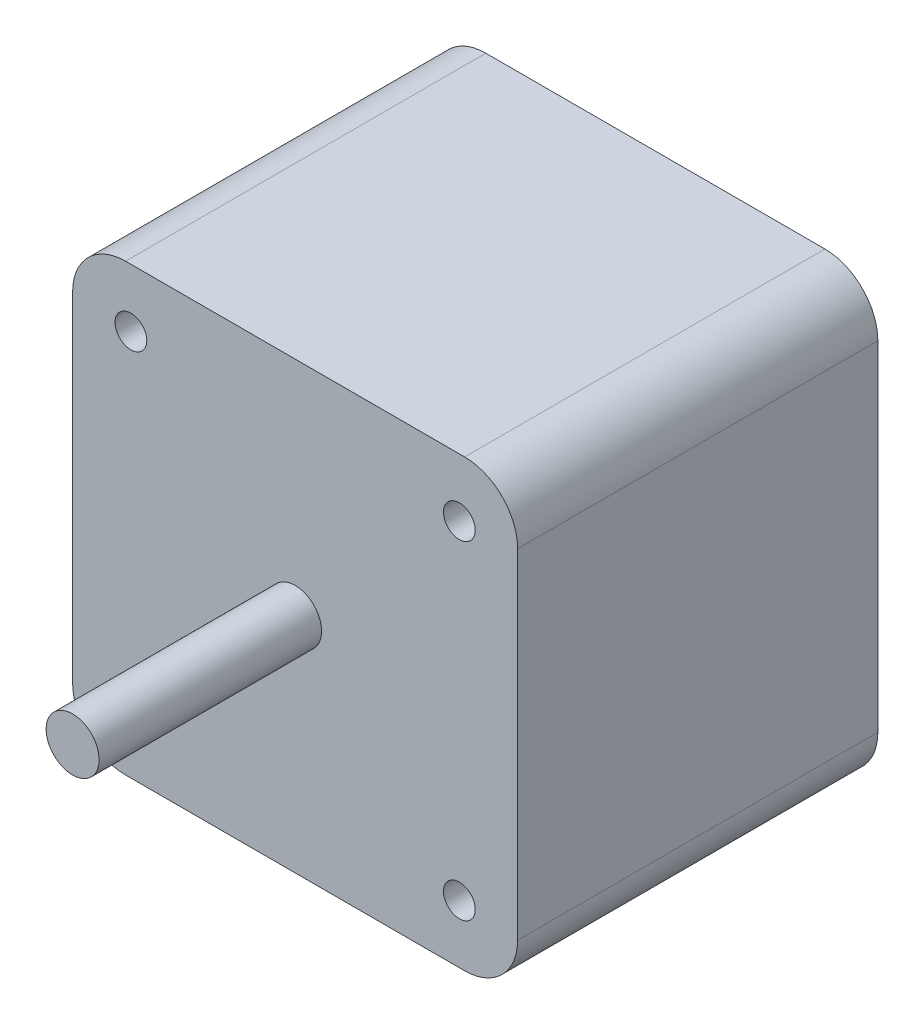
from build123d import *

# Parameters (mm, degrees)
SZKIC1_W                    = 42
SZKIC1_H                    = 42
DODANIE_WYCI_GNI_CIE1_DEPTH = 34
SZKIC2_R                    = 1.5
WYTNIJ_WYCI_GNI_CIE1_DEPTH  = 11
SZKIC6_R                    = 1.5
WYTNIJ_WYCI_GNI_CIE2_DEPTH  = 11
SZKIC7_R                    = 1.5
WYTNIJ_WYCI_GNI_CIE3_DEPTH  = 11
SZKIC8_R                    = 1.5
WYTNIJ_WYCI_GNI_CIE4_DEPTH  = 11
ZAOKR_GLENIE1_R             = 5
SZKIC9_R                    = 2.5
DODANIE_WYCI_GNI_CIE4_DEPTH = 21
WYTNIJ_WYCI_GNI_CIE5_DEPTH  = 1


with BuildPart() as part:
    # Szkic1 → Dodanie-wyciągnięcie1 (new body)
    with BuildSketch(Plane.XY):
        Rectangle(SZKIC1_W, SZKIC1_H)
    extrude(amount=DODANIE_WYCI_GNI_CIE1_DEPTH)

    # Szkic2 → Wytnij-wyciągnięcie1 (cut)
    with BuildSketch(Plane.XY.offset(34)):
        with Locations((15.5, 15.5)):
            Circle(SZKIC2_R)
    extrude(amount=-WYTNIJ_WYCI_GNI_CIE1_DEPTH, mode=Mode.SUBTRACT)

    # Szkic6 → Wytnij-wyciągnięcie2 (cut)
    with BuildSketch(Plane.XY.offset(34)):
        with Locations((-15.5, 15.5)):
            Circle(SZKIC6_R)
    extrude(amount=-WYTNIJ_WYCI_GNI_CIE2_DEPTH, mode=Mode.SUBTRACT)

    # Szkic7 → Wytnij-wyciągnięcie3 (cut)
    with BuildSketch(Plane.XY.offset(34)):
        with Locations((-15.5, -15.5)):
            Circle(SZKIC7_R)
    extrude(amount=-WYTNIJ_WYCI_GNI_CIE3_DEPTH, mode=Mode.SUBTRACT)

    # Szkic8 → Wytnij-wyciągnięcie4 (cut)
    with BuildSketch(Plane.XY.offset(34)):
        with Locations((15.5, -15.5)):
            Circle(SZKIC8_R)
    extrude(amount=-WYTNIJ_WYCI_GNI_CIE4_DEPTH, mode=Mode.SUBTRACT)

    # Zaokrąglenie1
    zaokr_glenie1_edges = [part.edges().sort_by_distance(p)[0] for p in [
        (21, -21, 17),
        (-21, -21, 17),
        (-21, 21, 17),
        (21, 21, 17),
    ]]
    fillet(zaokr_glenie1_edges, radius=ZAOKR_GLENIE1_R)

    # Szkic9 → Dodanie-wyciągnięcie4 (add)
    with BuildSketch(Plane.XY.offset(34)):
        with Locations(Location((0, 0, 0), (0, 0, 180))):
            Circle(SZKIC9_R)
    extrude(amount=DODANIE_WYCI_GNI_CIE4_DEPTH)

    # Szkic11 → Wytnij-wyciągnięcie5 (cut)
    # profile 1 of 6: a face of its own
    with BuildSketch(Plane(origin=(0, 0, 0), x_dir=(-1, 0, 0), z_dir=(0, 0, -1))):
        Polygon((-7.658605606, 0.036910524), (-7.658605606, 3.536910524), (-7.592700157, 3.536910524), (-5.280400478, 0.782202992), (-5.280400478, 3.536910524), (-4.966297913, 3.536910524), (-4.966297913, 0.036910524), (-5.037812336, 0.036910524), (-7.344503042, 2.78530796), (-7.344503042, 0.036910524), align=None)
    # profile 2 of 6: a face of its own
    with BuildSketch(Plane(origin=(0, 0, 0), x_dir=(-1, 0, 0), z_dir=(0, 0, -1))):
        Polygon((-4.068862016, 3.536910524), (-2.094503042, 3.536910524), (-2.094503042, 3.177936165), (-3.754759452, 3.177936165), (-3.754759452, 2.101013088), (-2.094503042, 2.101013088), (-2.094503042, 1.742038729), (-3.754759452, 1.742038729), (-3.754759452, 0.395884883), (-2.094503042, 0.395884883), (-2.094503042, 0.036910524), (-4.068862016, 0.036910524), align=None)
    # profile 3 of 6: a face of its own
    with BuildSketch(Plane(origin=(0, 0, 0), x_dir=(-1, 0, 0), z_dir=(0, 0, -1))):
        Polygon((-1.645785093, 0.036910524), (-1.18374583, 3.536910524), (-1.138874035, 3.536910524), (0.306137984, 0.665115652), (1.747644394, 3.536910524), (1.793217311, 3.536910524), (2.258061061, 0.036910524), (1.942556253, 0.036910524), (1.607420035, 2.555340011), (0.343998561, 0.036910524), (0.27318526, 0.036910524), (-0.995144067, 2.560948986), (-1.329579163, 0.036910524), align=None)
    # profile 4 of 6: a face of its own
    with BuildSketch(Plane(origin=(0, 0, 0), x_dir=(-1, 0, 0), z_dir=(0, 0, -1))):
        Polygon((4.411907215, 3.536910524), (6.02729183, 0.036910524), (5.685845516, 0.036910524), (5.168417631, 1.158705396), (3.58177901, 1.158705396), (3.049627567, 0.036910524), (2.70677901, 0.036910524), (4.36703542, 3.536910524), align=None)
        Polygon((4.385965708, 2.854719018), (3.752151606, 1.517679755), (5.002952888, 1.517679755), align=None, mode=Mode.SUBTRACT)
    # profile 5 of 6: a face of its own
    with BuildSketch(Plane(origin=(0, 0, 0), x_dir=(-1, 0, 0), z_dir=(0, 0, -1))):
        Polygon((8.431438465, 3.536910524), (9.078573881, 3.536910524), (9.078573881, 0.036910524), (8.764471317, 0.036910524), (8.764471317, 3.177936165), (8.226009779, 3.177936165), align=None)
    # profile 6 of 6: a face of its own
    with BuildSketch(Plane(origin=(0, 0, 0), x_dir=(-1, 0, 0), z_dir=(0, 0, -1))):
        Polygon((10.604214907, 3.536910524), (12.758061061, 3.536910524), (10.918317471, -0.052833066), (10.646983337, 0.096505877), (12.22661074, 3.177936165), (10.604214907, 3.177936165), align=None)
    extrude(amount=-WYTNIJ_WYCI_GNI_CIE5_DEPTH, mode=Mode.SUBTRACT)


solid = part.part
